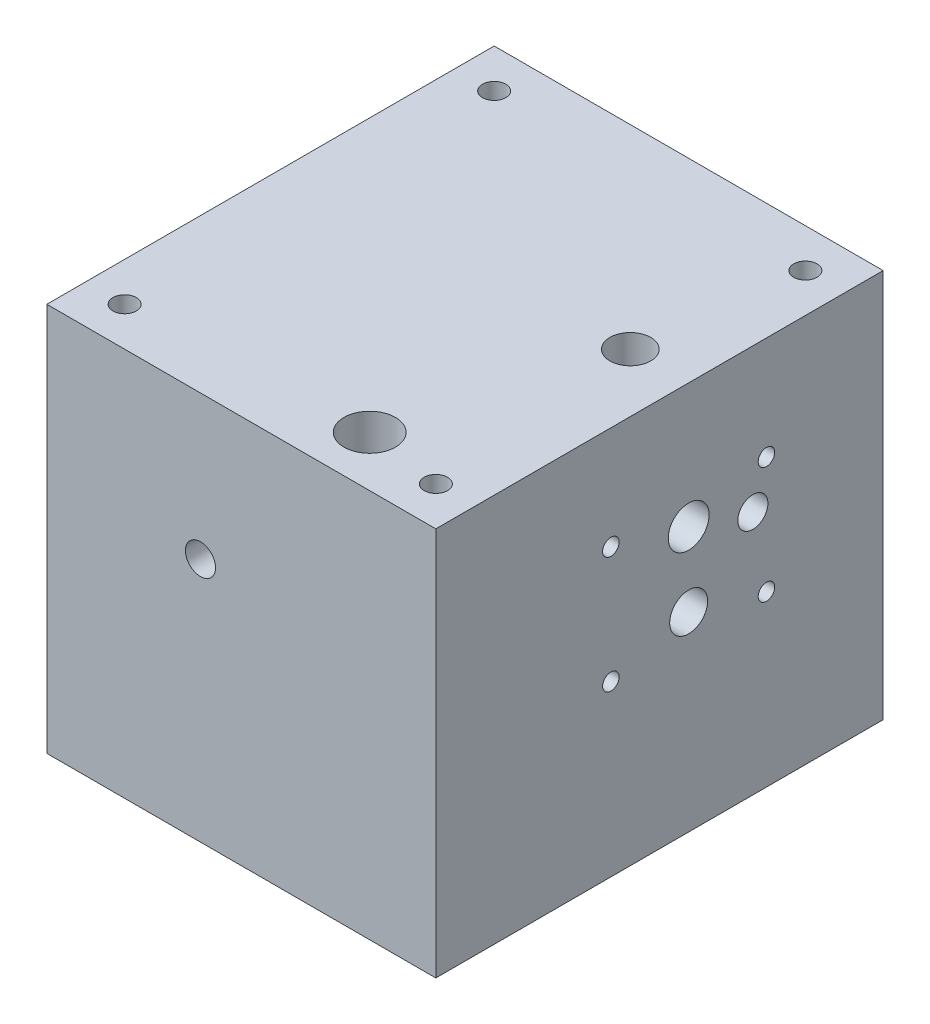
from build123d import *

# Parameters (mm, degrees)
SKETCH_1_W                     = 200
SKETCH_1_H                     = 200
EXTRUDE_1_DEPTH                = 200
HOLE_WIZARD_M10_1_D            = 8.5
HOLE_WIZARD_M10_1_DEPTH        = 17
HOLE_WIZARD_M10_1_TIP          = 2.553657631
HOLE_WIZARD_M8_1_D             = 6.8
HOLE_WIZARD_M8_1_DEPTH         = 25
HOLE_WIZARD_M8_1_TIP           = 2.042926105
HOLE_WIZARD_M14_2_D            = 12
HOLE_WIZARD_M14_2_DEPTH        = 17
HOLE_WIZARD_M14_2_TIP          = 3.605163714
HOLE_WIZARD_M24_1_D            = 21
HOLE_WIZARD_M24_1_DEPTH        = 60
HOLE_WIZARD_M24_1_TIP          = 6.3090365
HOLE_WIZARD_M24_2_D            = 21
HOLE_WIZARD_M24_2_DEPTH        = 42
HOLE_WIZARD_M24_2_TIP          = 6.3090365
HOLE_WIZARD_M22_1_D            = 19.5
HOLE_WIZARD_M22_1_DEPTH        = 111
HOLE_WIZARD_M22_1_TIP          = 5.858391036
HOLE_WIZARD_M22_3_D            = 19.5
HOLE_WIZARD_M22_3_DEPTH        = 90
HOLE_WIZARD_M22_3_TIP          = 5.858391036
HOLE_WIZARD_M22_4_D            = 19.5
HOLE_WIZARD_M22_4_DEPTH        = 75
HOLE_WIZARD_M22_4_TIP          = 5.858391036
HOLE_WIZARD_M18_1_D            = 15.5
HOLE_WIZARD_M18_1_DEPTH        = 88
HOLE_WIZARD_M18_1_TIP          = 4.656669797
HOLE_WIZARD_M18_4_D            = 15.5
HOLE_WIZARD_M18_4_DEPTH        = 130
HOLE_WIZARD_M18_4_TIP          = 4.656669797
HOLE_WIZARD_M22_5_D            = 19.5
HOLE_WIZARD_M22_5_DEPTH        = 79
HOLE_WIZARD_M22_5_TIP          = 5.858391036
HOLE_WIZARD_M10_2_D            = 8.5
HOLE_WIZARD_M10_2_DEPTH        = 10
HOLE_WIZARD_M10_2_TIP          = 2.553657631
HOLE_WIZARD_M10_1_2_D          = 8.5
HOLE_WIZARD_M10_1_2_DEPTH      = 40
HOLE_WIZARD_M10_1_2_TIP        = 2.553657631
HOLE_WIZARD_M10_2_2_AT_2_COUNT = 2
HOLE_WIZARD_M10_2_2_AT_2_PITCH = 25
HOLE_WIZARD_M24_3_D            = 21
HOLE_WIZARD_M24_3_DEPTH        = 40.5
HOLE_WIZARD_M24_3_TIP          = 6.3090365
HOLE_WIZARD_M24_4_D            = 21
HOLE_WIZARD_M24_4_DEPTH        = 62
HOLE_WIZARD_M24_4_TIP          = 6.3090365
HOLE_WIZARD_M18_5_D            = 15.5
HOLE_WIZARD_M18_5_DEPTH        = 133
HOLE_WIZARD_M18_5_TIP          = 4.656669797
HOLE_WIZARD_M18_7_D            = 15.5
HOLE_WIZARD_M18_7_DEPTH        = 107.7
HOLE_WIZARD_M18_7_TIP          = 4.656669797
HOLE_WIZARD_M18_8_REACH        = 199.596
HOLE_WIZARD_M18_8_BORE_R       = 7.75
HOLE_WIZARD_M22_6_D            = 19.5
HOLE_WIZARD_M22_6_DEPTH        = 39.75
HOLE_WIZARD_M22_6_TIP          = 5.858391036
SKETCH_110_W                   = 200
SKETCH_110_H                   = 200
EXTRUDE_2_DEPTH                = 30
HOLE_WIZARD_M14_2_2_D          = 12
HOLE_WIZARD_M18_9_D            = 15.5
HOLE_WIZARD_M18_9_DEPTH        = 62
HOLE_WIZARD_M18_9_TIP          = 4.656669797
HOLE_WIZARD_M30_1_D            = 26.5


with BuildPart() as part:
    # 草图1 → 凸台-拉伸1 (new body)
    with BuildSketch(Plane(origin=(0, 0, 0), x_dir=(1, 0, 0), z_dir=(0, 1, 0))):
        Rectangle(SKETCH_1_W, SKETCH_1_H)
    extrude(amount=EXTRUDE_1_DEPTH)

    # Hole Wizard M10 _1
    with Locations(Plane(origin=(100, 0, 0), x_dir=(0, 0, -1), z_dir=(1, 0, 0))):
        with Locations((-40, 87), (-40, 147), (40, 147), (40, 87)):
            Hole(HOLE_WIZARD_M10_1_D / 2, depth=HOLE_WIZARD_M10_1_DEPTH)
            with Locations((0, 0, -(HOLE_WIZARD_M10_1_DEPTH + HOLE_WIZARD_M10_1_TIP / 2))):  # 118° drill point
                Cone(0, HOLE_WIZARD_M10_1_D / 2, HOLE_WIZARD_M10_1_TIP, mode=Mode.SUBTRACT)

    # M8 螺纹孔1
    with Locations(Plane(origin=(0, 0, -100), x_dir=(-1, 0, 0), z_dir=(0, 0, -1))):
        with Locations((-44, 107), (-21, 53), (21, 53), (44, 107)):
            Hole(HOLE_WIZARD_M8_1_D / 2, depth=HOLE_WIZARD_M8_1_DEPTH)
            with Locations((0, 0, -(HOLE_WIZARD_M8_1_DEPTH + HOLE_WIZARD_M8_1_TIP / 2))):  # 118° drill point
                Cone(0, HOLE_WIZARD_M8_1_D / 2, HOLE_WIZARD_M8_1_TIP, mode=Mode.SUBTRACT)

    # Hole Wizard M14 _2
    with Locations(Plane.ZY.offset(100)):
        with Locations((23, 125.040370805), (-31, 125.040370805), (-31, 71.040370805), (23, 71.040370805)):
            Hole(HOLE_WIZARD_M14_2_D / 2, depth=HOLE_WIZARD_M14_2_DEPTH)
            with Locations((0, 0, -(HOLE_WIZARD_M14_2_DEPTH + HOLE_WIZARD_M14_2_TIP / 2))):  # 118° drill point
                Cone(0, HOLE_WIZARD_M14_2_D / 2, HOLE_WIZARD_M14_2_TIP, mode=Mode.SUBTRACT)

    # M24 螺纹孔的螺纹孔钻头1
    with Locations(Plane(origin=(0, 200, 0), x_dir=(1, 0, 0), z_dir=(0, 1, 0))):
        with Locations((70, 0)):
            Hole(HOLE_WIZARD_M24_1_D / 2, depth=HOLE_WIZARD_M24_1_DEPTH)
            with Locations((0, 0, -(HOLE_WIZARD_M24_1_DEPTH + HOLE_WIZARD_M24_1_TIP / 2))):  # 118° drill point
                Cone(0, HOLE_WIZARD_M24_1_D / 2, HOLE_WIZARD_M24_1_TIP, mode=Mode.SUBTRACT)

    # M24 螺纹孔的螺纹孔钻头2
    with Locations(Plane(origin=(100, 0, 0), x_dir=(0, 0, -1), z_dir=(1, 0, 0))):
        with Locations((0, 136)):
            Hole(HOLE_WIZARD_M24_2_D / 2, depth=HOLE_WIZARD_M24_2_DEPTH)
            with Locations((0, 0, -(HOLE_WIZARD_M24_2_DEPTH + HOLE_WIZARD_M24_2_TIP / 2))):  # 118° drill point
                Cone(0, HOLE_WIZARD_M24_2_D / 2, HOLE_WIZARD_M24_2_TIP, mode=Mode.SUBTRACT)

    # M22 螺纹孔的螺纹孔钻头1
    with Locations(Plane(origin=(0, 0, -100), x_dir=(-1, 0, 0), z_dir=(0, 0, -1))):
        with Locations((-21, 98)):
            Hole(HOLE_WIZARD_M22_1_D / 2, depth=HOLE_WIZARD_M22_1_DEPTH)
            with Locations((0, 0, -(HOLE_WIZARD_M22_1_DEPTH + HOLE_WIZARD_M22_1_TIP / 2))):  # 118° drill point
                Cone(0, HOLE_WIZARD_M22_1_D / 2, HOLE_WIZARD_M22_1_TIP, mode=Mode.SUBTRACT)

    # M22 螺纹孔的螺纹孔钻头3
    with Locations(Plane.ZY.offset(100)):
        with Locations((-25, 98)):
            Hole(HOLE_WIZARD_M22_3_D / 2, depth=HOLE_WIZARD_M22_3_DEPTH)
            with Locations((0, 0, -(HOLE_WIZARD_M22_3_DEPTH + HOLE_WIZARD_M22_3_TIP / 2))):  # 118° drill point
                Cone(0, HOLE_WIZARD_M22_3_D / 2, HOLE_WIZARD_M22_3_TIP, mode=Mode.SUBTRACT)

    # M22 螺纹孔的螺纹孔钻头4
    with Locations(Plane(origin=(0, 0, -100), x_dir=(-1, 0, 0), z_dir=(0, 0, -1))):
        with Locations((21, 98)):
            Hole(HOLE_WIZARD_M22_4_D / 2, depth=HOLE_WIZARD_M22_4_DEPTH)
            with Locations((0, 0, -(HOLE_WIZARD_M22_4_DEPTH + HOLE_WIZARD_M22_4_TIP / 2))):  # 118° drill point
                Cone(0, HOLE_WIZARD_M22_4_D / 2, HOLE_WIZARD_M22_4_TIP, mode=Mode.SUBTRACT)

    # M18 螺纹孔的螺纹孔钻头1
    with Locations(Plane.ZY.offset(100)):
        with Locations((0, 98.040370805)):
            Hole(HOLE_WIZARD_M18_1_D / 2, depth=HOLE_WIZARD_M18_1_DEPTH)
            with Locations((0, 0, -(HOLE_WIZARD_M18_1_DEPTH + HOLE_WIZARD_M18_1_TIP / 2))):  # 118° drill point
                Cone(0, HOLE_WIZARD_M18_1_D / 2, HOLE_WIZARD_M18_1_TIP, mode=Mode.SUBTRACT)

    # M18 螺纹孔的螺纹孔钻头4
    with Locations(Plane(origin=(100, 0, 0), x_dir=(0, 0, -1), z_dir=(1, 0, 0))):
        with Locations((33, 126)):
            Hole(HOLE_WIZARD_M18_4_D / 2, depth=HOLE_WIZARD_M18_4_DEPTH)
            with Locations((0, 0, -(HOLE_WIZARD_M18_4_DEPTH + HOLE_WIZARD_M18_4_TIP / 2))):  # 118° drill point
                Cone(0, HOLE_WIZARD_M18_4_D / 2, HOLE_WIZARD_M18_4_TIP, mode=Mode.SUBTRACT)

    # M22 螺纹孔的螺纹孔钻头5
    with Locations(Plane(origin=(100, 0, 0), x_dir=(0, 0, -1), z_dir=(1, 0, 0))):
        with Locations((0, 98)):
            Hole(HOLE_WIZARD_M22_5_D / 2, depth=HOLE_WIZARD_M22_5_DEPTH)
            with Locations((0, 0, -(HOLE_WIZARD_M22_5_DEPTH + HOLE_WIZARD_M22_5_TIP / 2))):  # 118° drill point
                Cone(0, HOLE_WIZARD_M22_5_D / 2, HOLE_WIZARD_M22_5_TIP, mode=Mode.SUBTRACT)

    # Hole Wizard M10 _2
    with Locations(Plane.ZY.offset(100)):
        with Locations((-9, 44), (-29, 44), (-29, 9), (-9, 9)):
            Hole(HOLE_WIZARD_M10_2_D / 2, depth=HOLE_WIZARD_M10_2_DEPTH)
            with Locations((0, 0, -(HOLE_WIZARD_M10_2_DEPTH + HOLE_WIZARD_M10_2_TIP / 2))):  # 118° drill point
                Cone(0, HOLE_WIZARD_M10_2_D / 2, HOLE_WIZARD_M10_2_TIP, mode=Mode.SUBTRACT)

    # Hole Wizard M10 _1 2
    with Locations(Plane.ZY.offset(100)):
        with Locations((0, 26.5), (-25, 26.5)):
            Hole(HOLE_WIZARD_M10_1_2_D / 2, depth=HOLE_WIZARD_M10_1_2_DEPTH)
            with Locations((0, 0, -(HOLE_WIZARD_M10_1_2_DEPTH + HOLE_WIZARD_M10_1_2_TIP / 2))):  # 118° drill point
                Cone(0, HOLE_WIZARD_M10_1_2_D / 2, HOLE_WIZARD_M10_1_2_TIP, mode=Mode.SUBTRACT)

    # 草图76 → Hole Wizard M10 _2 2 (revolve, cut)
    with BuildSketch(Plane(origin=(-64.25, 26.5, 0), x_dir=(0, 0, -1), z_dir=(1, 0, 0))):
        Polygon((0, 0), (0, 74.053657631), (4.25, 71.5), (4.25, 0), align=None)
    hole_wizard_m10_2_2 = revolve(axis=Axis((-64.25, 20.15, 0), (0, 1, 0)), mode=Mode.SUBTRACT)

    # Hole Wizard M10 _2 2 at 2: Hole Wizard M10 _2 2 ×2
    with Locations(*[(0, 0, -i * HOLE_WIZARD_M10_2_2_AT_2_PITCH) for i in range(1, HOLE_WIZARD_M10_2_2_AT_2_COUNT)]):
        add(hole_wizard_m10_2_2, mode=Mode.SUBTRACT)

    # M24 螺纹孔的螺纹孔钻头3
    with Locations(Plane(origin=(0, 0, -100), x_dir=(-1, 0, 0), z_dir=(0, 0, -1))):
        with Locations((0, 62)):
            Hole(HOLE_WIZARD_M24_3_D / 2, depth=HOLE_WIZARD_M24_3_DEPTH)
            with Locations((0, 0, -(HOLE_WIZARD_M24_3_DEPTH + HOLE_WIZARD_M24_3_TIP / 2))):  # 118° drill point
                Cone(0, HOLE_WIZARD_M24_3_D / 2, HOLE_WIZARD_M24_3_TIP, mode=Mode.SUBTRACT)

    # M24 螺纹孔的螺纹孔钻头4
    with Locations(Plane(origin=(0, 0, 0), x_dir=(-1, 0, 0), z_dir=(0, -1, 0))):
        with Locations((0, 70)):
            Hole(HOLE_WIZARD_M24_4_D / 2, depth=HOLE_WIZARD_M24_4_DEPTH)
            with Locations((0, 0, -(HOLE_WIZARD_M24_4_DEPTH + HOLE_WIZARD_M24_4_TIP / 2))):  # 118° drill point
                Cone(0, HOLE_WIZARD_M24_4_D / 2, HOLE_WIZARD_M24_4_TIP, mode=Mode.SUBTRACT)

    # M18 螺纹孔的螺纹孔钻头5
    with Locations(Plane.XY.offset(100)):
        with Locations((-21, 126)):
            Hole(HOLE_WIZARD_M18_5_D / 2, depth=HOLE_WIZARD_M18_5_DEPTH)
            with Locations((0, 0, -(HOLE_WIZARD_M18_5_DEPTH + HOLE_WIZARD_M18_5_TIP / 2))):  # 118° drill point
                Cone(0, HOLE_WIZARD_M18_5_D / 2, HOLE_WIZARD_M18_5_TIP, mode=Mode.SUBTRACT)

    # 草图90 → M18 螺纹孔的螺纹孔钻头6 (revolve, cut)
    with BuildSketch(Plane(origin=(-21, 100, 0), x_dir=(0, 0, -1), z_dir=(1, 0, 0))):
        Polygon((0, 0), (0, 32.656669797), (7.75, 28), (7.75, 0), align=None)
    revolve(axis=Axis((-21, 93.65, 0), (0, 1, 0)), mode=Mode.SUBTRACT)

    # M18 螺纹孔的螺纹孔钻头7
    with Locations(Plane(origin=(0, 0, -100), x_dir=(-1, 0, 0), z_dir=(0, 0, -1))):
        with Locations((42, 62)):
            Hole(HOLE_WIZARD_M18_7_D / 2, depth=HOLE_WIZARD_M18_7_DEPTH)
            with Locations((0, 0, -(HOLE_WIZARD_M18_7_DEPTH + HOLE_WIZARD_M18_7_TIP / 2))):  # 118° drill point
                Cone(0, HOLE_WIZARD_M18_7_D / 2, HOLE_WIZARD_M18_7_TIP, mode=Mode.SUBTRACT)

    # M18 螺纹孔的螺纹孔钻头8 bore → M18 螺纹孔的螺纹孔钻头8 (cut, up to next)
    with BuildSketch(Plane(origin=(0, 62, 0), x_dir=(-1, 0, 0), z_dir=(0, -1, 0)), mode=Mode.PRIVATE) as hole_wizard_m18_8_sk1:
        with Locations((42, 0)):
            Circle(HOLE_WIZARD_M18_8_BORE_R)
    hole_wizard_m18_8_tool1 = extrude(hole_wizard_m18_8_sk1.sketch, amount=-HOLE_WIZARD_M18_8_REACH, mode=Mode.PRIVATE) & part.part
    add(hole_wizard_m18_8_tool1.solids().sort_by_distance((-42, 62, 0))[0], mode=Mode.SUBTRACT)

    # M22 螺纹孔的螺纹孔钻头6
    with Locations(Plane(origin=(0, 0, -100), x_dir=(-1, 0, 0), z_dir=(0, 0, -1))):
        with Locations((-21, 160)):
            Hole(HOLE_WIZARD_M22_6_D / 2, depth=HOLE_WIZARD_M22_6_DEPTH)
            with Locations((0, 0, -(HOLE_WIZARD_M22_6_DEPTH + HOLE_WIZARD_M22_6_TIP / 2))):  # 118° drill point
                Cone(0, HOLE_WIZARD_M22_6_D / 2, HOLE_WIZARD_M22_6_TIP, mode=Mode.SUBTRACT)

    # 草图109 → M22 螺纹孔的螺纹孔钻头7 (revolve, cut)
    with BuildSketch(Plane(origin=(21, 160, -70), x_dir=(0, 0, 1), z_dir=(1, 0, 0))):
        Polygon((0, 0), (0, 67.858391036), (9.75, 62), (9.75, 0), align=None)
    revolve(axis=Axis((21, 166.35, -70), (0, -1, 0)), mode=Mode.SUBTRACT)

    # 草图110 → 凸台-拉伸2 (add)
    with BuildSketch(Plane.XY.offset(100)):
        with Locations((0, 100)):
            Rectangle(SKETCH_110_W, SKETCH_110_H)
    extrude(amount=EXTRUDE_2_DEPTH)

    # Hole Wizard M14 _2 2 (through all)
    with Locations(Plane(origin=(0, 0, 0), x_dir=(-1, 0, 0), z_dir=(0, -1, 0))):
        with Locations((-80, -110), (80, -110), (80, 80), (-80, 80)):
            Hole(HOLE_WIZARD_M14_2_2_D / 2)

    # M18 螺纹孔的螺纹孔钻头9
    with Locations(Plane.XY.offset(130)):
        with Locations((-21, 126)):
            Hole(HOLE_WIZARD_M18_9_D / 2, depth=HOLE_WIZARD_M18_9_DEPTH)
            with Locations((0, 0, -(HOLE_WIZARD_M18_9_DEPTH + HOLE_WIZARD_M18_9_TIP / 2))):  # 118° drill point
                Cone(0, HOLE_WIZARD_M18_9_D / 2, HOLE_WIZARD_M18_9_TIP, mode=Mode.SUBTRACT)

    # M30 螺纹孔的螺纹孔钻头1 (through all)
    with Locations(Plane(origin=(0, 0, 0), x_dir=(-1, 0, 0), z_dir=(0, -1, 0))):
        with Locations((-40, -104)):
            Hole(HOLE_WIZARD_M30_1_D / 2)


solid = part.part
